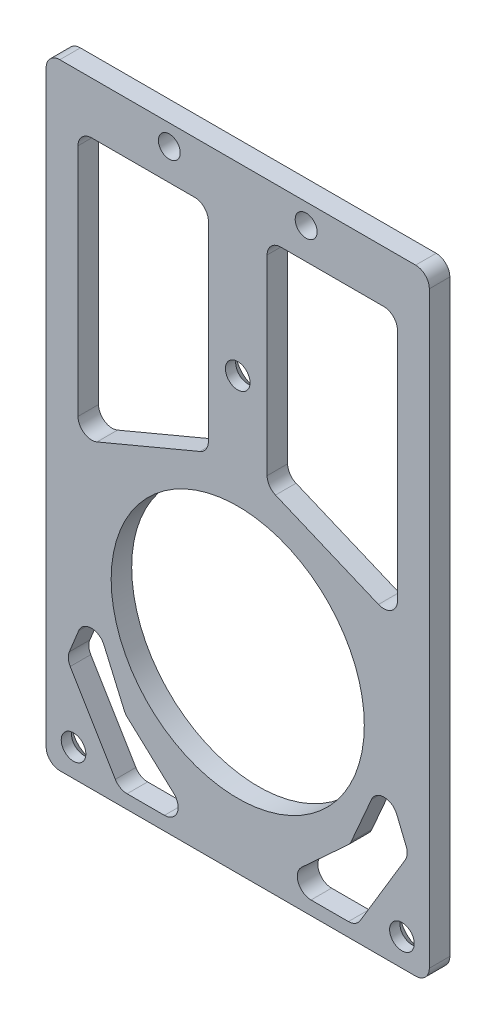
from build123d import *

# Parameters (mm, degrees)
SKETCH_1_W                  = 56
SKETCH_1_H                  = 90
SKETCH_1_R                  = 1.6
EXTRUDE_1_DEPTH             = 3
SKETCH_2_R                  = 18.5
SKETCH_2_R_2                = 1.6
CUT_EXTRUDE_1_DEPTH         = 54.08483776
FILLET_1_R                  = 2
CUT_EXTRUDE_2_DEPTH         = 54.08483776
FILLET_2_R                  = 2
HOLE_WIZARD_M3_1_AT_2_COUNT = 2
HOLE_WIZARD_M3_1_AT_2_PITCH = 63.694583757
HOLE_WIZARD_M3_1_AT_3_COUNT = 2
HOLE_WIZARD_M3_1_AT_3_PITCH = 63.694583757


with BuildPart() as part:
    # 草图1 → 凸台-拉伸1 (new body)
    with BuildSketch(Plane.XY):
        Rectangle(SKETCH_1_W, SKETCH_1_H)
        with Locations((10, 42)):
            Circle(SKETCH_1_R, mode=Mode.SUBTRACT)
        with Locations(Location((-10, 42, 0), (0, 0, 180))):
            Circle(SKETCH_1_R, mode=Mode.SUBTRACT)
    extrude(amount=EXTRUDE_1_DEPTH)

    # 草图2 → 切除-拉伸1 (cut, through all)
    with BuildSketch(Plane.XY.offset(3)):
        with Locations((0, -17)):
            Circle(SKETCH_2_R)
        with Locations((0, 18)):
            Circle(SKETCH_2_R_2)
        with Locations((24, -41)):
            Circle(SKETCH_2_R_2)
        with Locations(Location((-24, -41, 0), (0, 0, 180))):
            Circle(SKETCH_2_R_2)
    extrude(amount=-CUT_EXTRUDE_1_DEPTH, mode=Mode.SUBTRACT)

    # 圆角1
    fillet_1_edges = [part.edges().sort_by_distance(p)[0] for p in [
        (28, -45, 1.5),
        (-28, -45, 1.5),
        (-28, 45, 1.5),
        (28, 45, 1.5),
    ]]
    fillet(fillet_1_edges, radius=FILLET_1_R)

    # 草图3 → 切除-拉伸2 (cut, through all)
    with BuildSketch(Plane.XY.offset(3)):
        Polygon((-23.345028529, 37.432122744), (-4.29507275, 37.432122744), (-4.29507275, 6.166928146), (-23.345028529, -1.831144891), align=None)
        Polygon((4.29507275, 6.166928146), (23.345028529, -1.831144891), (23.345028529, 37.432122744), (4.29507275, 37.432122744), align=None)
        Polygon((-21.449213, -21.510239836), (-24.998316916, -30.185827186), (-17.308591765, -43.00203577), (-5.576831599, -43.00203577), (-16.421315786, -33.044827562), align=None)
        Polygon((21.449213, -21.510239836), (24.998316916, -30.185827186), (17.308591765, -43.00203577), (5.576831599, -43.00203577), (16.421315786, -33.044827562), align=None)
    extrude(amount=-CUT_EXTRUDE_2_DEPTH, mode=Mode.SUBTRACT)

    # 圆角2
    fillet_2_edges = [part.edges().sort_by_distance(p)[0] for p in [
        (-5.576831599, -43.00203577, 1.5),
        (-17.308591765, -43.00203577, 1.5),
        (-24.998316916, -30.185827186, 1.5),
        (-21.449213, -21.510239836, 1.5),
        (-16.421315786, -33.044827562, 1.5),
        (-23.345028529, -1.831144891, 1.5),
        (-23.345028529, 37.432122744, 1.5),
        (-4.29507275, 37.432122744, 1.5),
        (-4.29507275, 6.166928146, 1.5),
        (4.29507275, 6.166928146, 1.5),
        (4.29507275, 37.432122744, 1.5),
        (23.345028529, 37.432122744, 1.5),
        (23.345028529, -1.831144891, 1.5),
        (16.421315786, -33.044827562, 1.5),
        (21.449213, -21.510239836, 1.5),
        (24.998316916, -30.185827186, 1.5),
        (17.308591765, -43.00203577, 1.5),
        (5.576831599, -43.00203577, 1.5),
    ]]
    fillet(fillet_2_edges, radius=FILLET_2_R)

    # 草图5 → M3 十字槽半沉头木螺钉的锥形沉头孔1 (revolve, cut)
    with BuildSketch(Plane(origin=(0, 18, 0), x_dir=(0, 1, 0), z_dir=(1, 0, 0))):
        Polygon((0, 0), (0, 3), (1.8, 3), (1.8, 1.5), (3.3, 0), align=None)
    hole_wizard_m3_1 = revolve(axis=Axis((0, 18, -6.35), (0, 0, 1)), mode=Mode.SUBTRACT)

    # M3 十字槽半沉头木螺钉的锥形沉头孔1 at 2: M3 十字槽半沉头木螺钉的锥形沉头孔1 ×2
    with Locations(*[Vector(-0.3767981292019326, -0.9262954009547514, 0) * (i * HOLE_WIZARD_M3_1_AT_2_PITCH) for i in range(1, HOLE_WIZARD_M3_1_AT_2_COUNT)]):
        add(hole_wizard_m3_1, mode=Mode.SUBTRACT)

    # M3 十字槽半沉头木螺钉的锥形沉头孔1 at 3: M3 十字槽半沉头木螺钉的锥形沉头孔1 ×2
    with Locations(*[Vector(0.3767981292019329, -0.9262954009547514, 0) * (i * HOLE_WIZARD_M3_1_AT_3_PITCH) for i in range(1, HOLE_WIZARD_M3_1_AT_3_COUNT)]):
        add(hole_wizard_m3_1, mode=Mode.SUBTRACT)


solid = part.part
